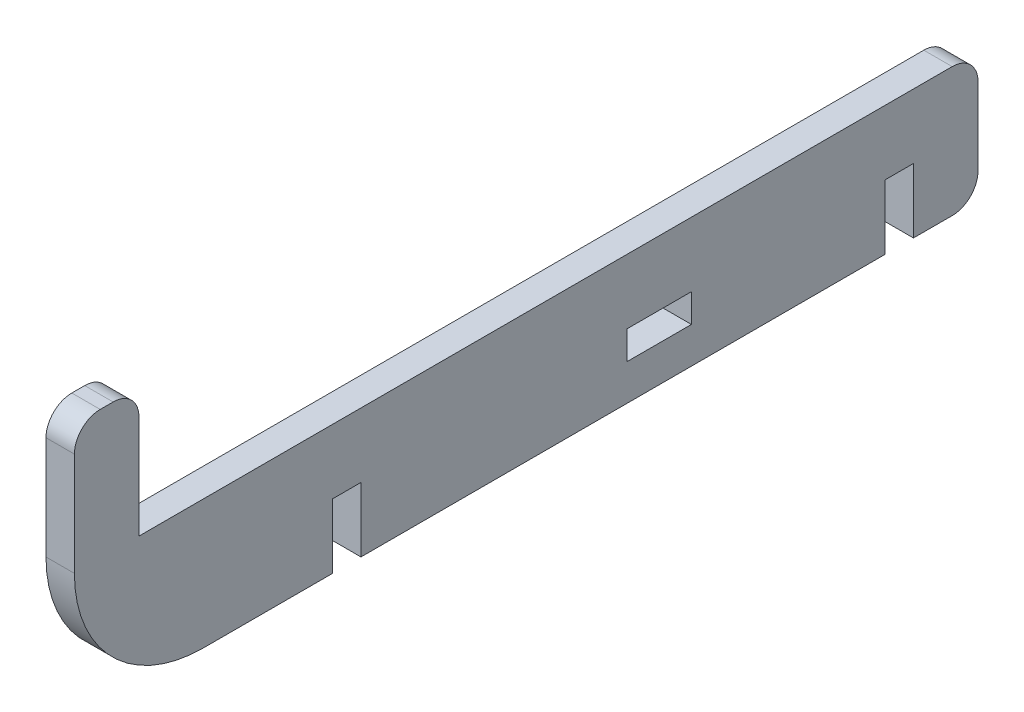
from build123d import *

# Parameters (mm, degrees)
BOSS_EXTRUDE1_DEPTH = 2.794
FILLET1_R           = 2.54
FILLET2_R           = 12.7
SKETCH2_W           = 2.794
SKETCH2_H           = 6.35
SKETCH2_W_2         = 6.35
SKETCH2_H_2         = 2.794
CUT_EXTRUDE1_DEPTH  = 93.499602356


with BuildPart() as part:
    # Sketch1 → Boss-Extrude1 (new body)
    with BuildSketch(Plane(origin=(0, 0, 0), x_dir=(0, 0, -1), z_dir=(1, 0, 0))):
        Polygon((0, 0), (88.9, 0), (88.9, 12.7), (6.35, 12.7), (6.35, 25.4), (0, 25.4), align=None)
    extrude(amount=BOSS_EXTRUDE1_DEPTH)

    # Fillet1
    fillet1_edges = [part.edges().sort_by_distance(p)[0] for p in [
        (1.397, 25.4, 0),
        (1.397, 25.4, -6.35),
        (1.397, 12.7, -88.9),
        (1.397, 0, -88.9),
    ]]
    fillet(fillet1_edges, radius=FILLET1_R)

    # Fillet2
    fillet2_edges = [part.edges().sort_by_distance(p)[0] for p in [
        (1.397, 0, 0),
    ]]
    fillet(fillet2_edges, radius=FILLET2_R)

    # Sketch2 → Cut-Extrude1 (cut, through all)
    with BuildSketch(Plane.ZY):
        with Locations((-26.797, 3.175)):
            Rectangle(SKETCH2_W, SKETCH2_H)
        with Locations((-81.153, 3.175)):
            Rectangle(SKETCH2_W, SKETCH2_H)
        with Locations((-57.531, 4.953)):
            Rectangle(SKETCH2_W_2, SKETCH2_H_2)
    extrude(amount=-CUT_EXTRUDE1_DEPTH, mode=Mode.SUBTRACT)


solid = part.part
